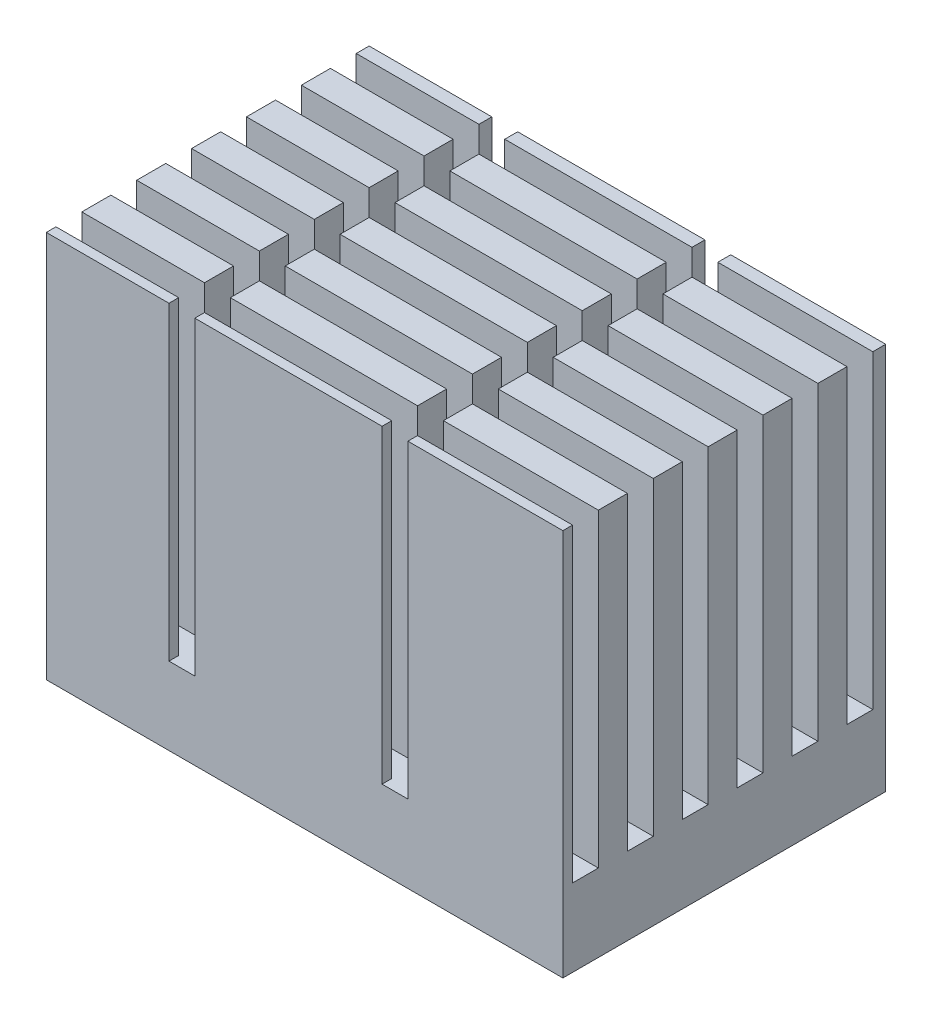
from build123d import *

# Parameters (mm, degrees)
SKETCH_1_W          = 40
SKETCH_1_H          = 25
EXTRUDE_1_DEPTH     = 30
SKETCH_2_W          = 40
SKETCH_2_H          = 2
CUT_EXTRUDE_1_DEPTH = 24
SKETCH_3_W          = 2
SKETCH_3_H          = 25
CUT_EXTRUDE_2_DEPTH = 24
SKETCH_4_R          = 1
CUT_EXTRUDE_3_DEPTH = 3


with BuildPart() as part:
    # 草图1 → 拉伸1 (new body)
    with BuildSketch(Plane(origin=(0, 0, 0), x_dir=(1, 0, 0), z_dir=(0, 1, 0))):
        Rectangle(SKETCH_1_W, SKETCH_1_H)
    extrude(amount=EXTRUDE_1_DEPTH)

    # 草图2 → 切除-拉伸1 (cut)
    with BuildSketch(Plane(origin=(0, 30, 0), x_dir=(-1, 0, 0), z_dir=(0, 1, 0))):
        with Locations((0, -10.5)):
            Rectangle(SKETCH_2_W, SKETCH_2_H)
        with Locations((0, -6.25)):
            Rectangle(SKETCH_2_W, SKETCH_2_H)
        with Locations((0, -2)):
            Rectangle(SKETCH_2_W, SKETCH_2_H)
        with Locations((0, 2.25)):
            Rectangle(SKETCH_2_W, SKETCH_2_H)
        with Locations((0, 6.5)):
            Rectangle(SKETCH_2_W, SKETCH_2_H)
        with Locations((0, 10.75)):
            Rectangle(SKETCH_2_W, SKETCH_2_H)
    extrude(amount=-CUT_EXTRUDE_1_DEPTH, mode=Mode.SUBTRACT)

    # 草图3 → 切除-拉伸2 (cut)
    with BuildSketch(Plane(origin=(0, 30, 0), x_dir=(-1, 0, 0), z_dir=(0, 1, 0))):
        with Locations((-7, 0)):
            Rectangle(SKETCH_3_W, SKETCH_3_H)
        with Locations((9.5, 0)):
            Rectangle(SKETCH_3_W, SKETCH_3_H)
    extrude(amount=-CUT_EXTRUDE_2_DEPTH, mode=Mode.SUBTRACT)

    # 草图4 → 切除-拉伸3 (cut)
    with BuildSketch(Plane.XZ):
        with Locations(Location((16, 0, 0), (0, 0, 270))):
            Circle(SKETCH_4_R)
        with Locations(Location((-16, 0, 0), (0, 0, 90))):
            Circle(SKETCH_4_R)
    extrude(amount=-CUT_EXTRUDE_3_DEPTH, mode=Mode.SUBTRACT)


solid = part.part
